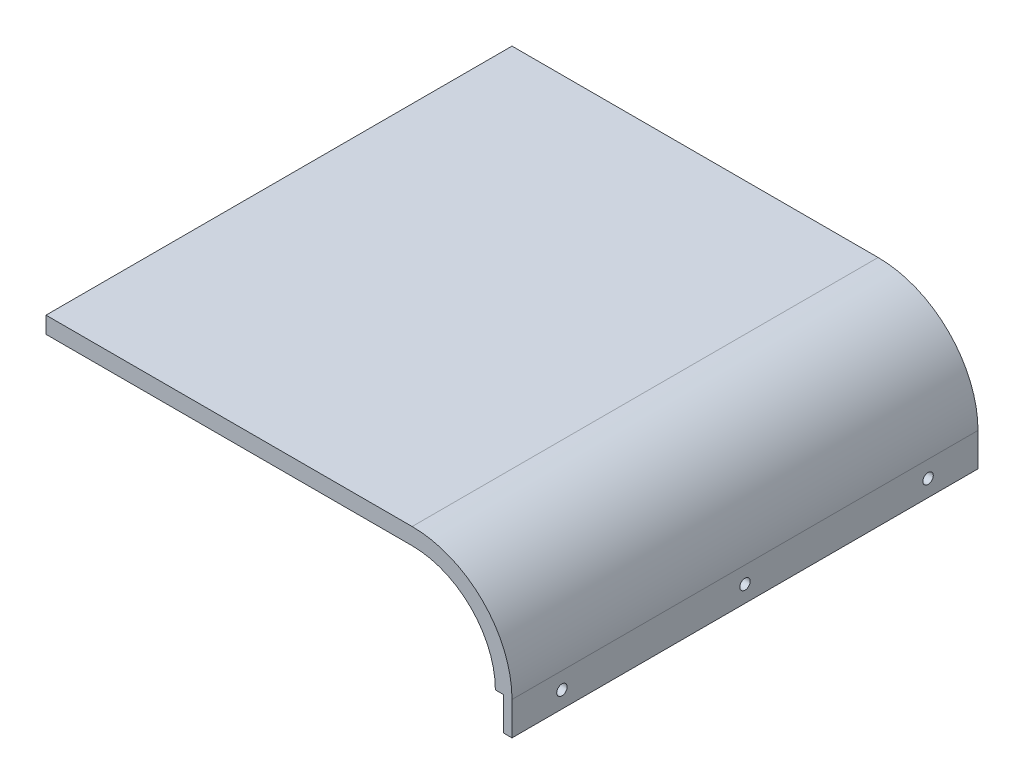
from build123d import *

# Parameters (mm, degrees)
BOSS_EXTRUDE1_DEPTH      = 177.8
BOSS_EXTRUDE1_DEPTH_BACK = 177.8
SKETCH2_W                = 6.35
SKETCH2_H                = 355.6
BOSS_EXTRUDE2_DEPTH      = 25.4
SKETCH3_R                = 3.96875
CUT_EXTRUDE1_DEPTH       = 25.4


with BuildPart() as part:
    # Sketch1 → Boss-Extrude1 (new, two sides: drawn at the far end of the back side and taken through both)
    with BuildSketch(Plane.XY.offset(-BOSS_EXTRUDE1_DEPTH_BACK)):
        with BuildLine():
            Line((-139.7, 0), (139.7, 0))
            ThreePointArc((139.7, 0), (193.581536726, -22.318463274), (215.9, -76.2))
            Line((215.9, -76.2), (203.2, -76.2))
            ThreePointArc((203.2, -76.2), (184.601280605, -31.298719395), (139.7, -12.7))
            Line((139.7, -12.7), (-139.7, -12.7))
            Line((-139.7, -12.7), (-139.7, 0))
        make_face()
    extrude(amount=BOSS_EXTRUDE1_DEPTH + BOSS_EXTRUDE1_DEPTH_BACK)

    # Sketch2 → Boss-Extrude2 (add)
    with BuildSketch(Plane.XZ.offset(76.2)):
        with Locations((212.725, 0)):
            Rectangle(SKETCH2_W, SKETCH2_H)
    extrude(amount=BOSS_EXTRUDE2_DEPTH)

    # Sketch3 → Cut-Extrude1 (cut)
    with BuildSketch(Plane(origin=(215.9, 0, 0), x_dir=(0, 0, -1), z_dir=(1, 0, 0))):
        with Locations((-139.7, -88.9)):
            Circle(SKETCH3_R)
        with Locations((0, -88.9)):
            Circle(SKETCH3_R)
        with Locations((139.7, -88.9)):
            Circle(SKETCH3_R)
    extrude(amount=-CUT_EXTRUDE1_DEPTH, mode=Mode.SUBTRACT)


solid = part.part
